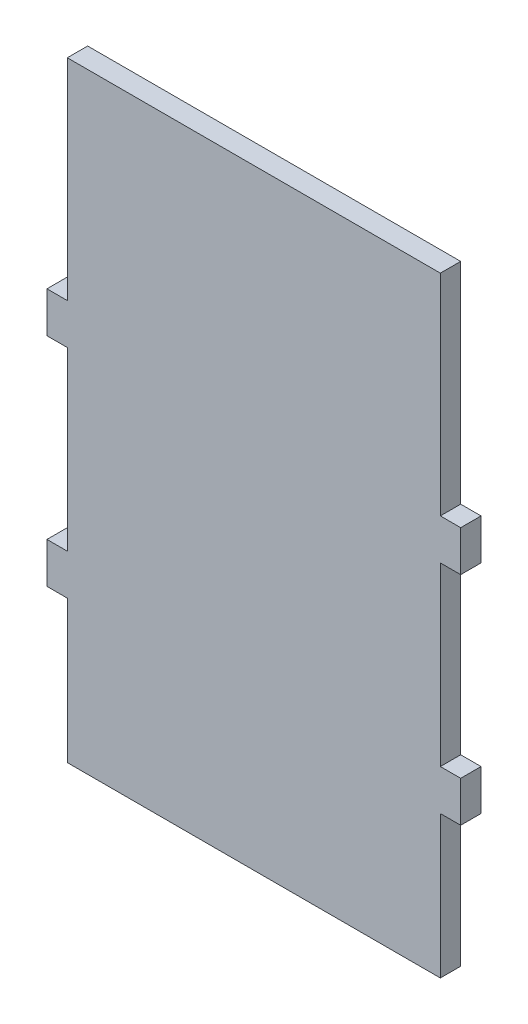
from build123d import *

# Parameters (mm, degrees)
P_IDAT_VYSUNUT_M1_DEPTH = 3


with BuildPart() as part:
    # Skica1 → Přidat vysunutím1 (new body)
    with BuildSketch(Plane.XY):
        Polygon((0, 0), (55, 0), (55, -31), (58, -31), (58, -37), (55, -37), (55, -63), (58, -63), (58, -69), (55, -69), (55, -90), (0, -90), (0, -69), (-3, -69), (-3, -63), (0, -63), (0, -37), (-3, -37), (-3, -31), (0, -31), align=None)
    extrude(amount=P_IDAT_VYSUNUT_M1_DEPTH)


solid = part.part
